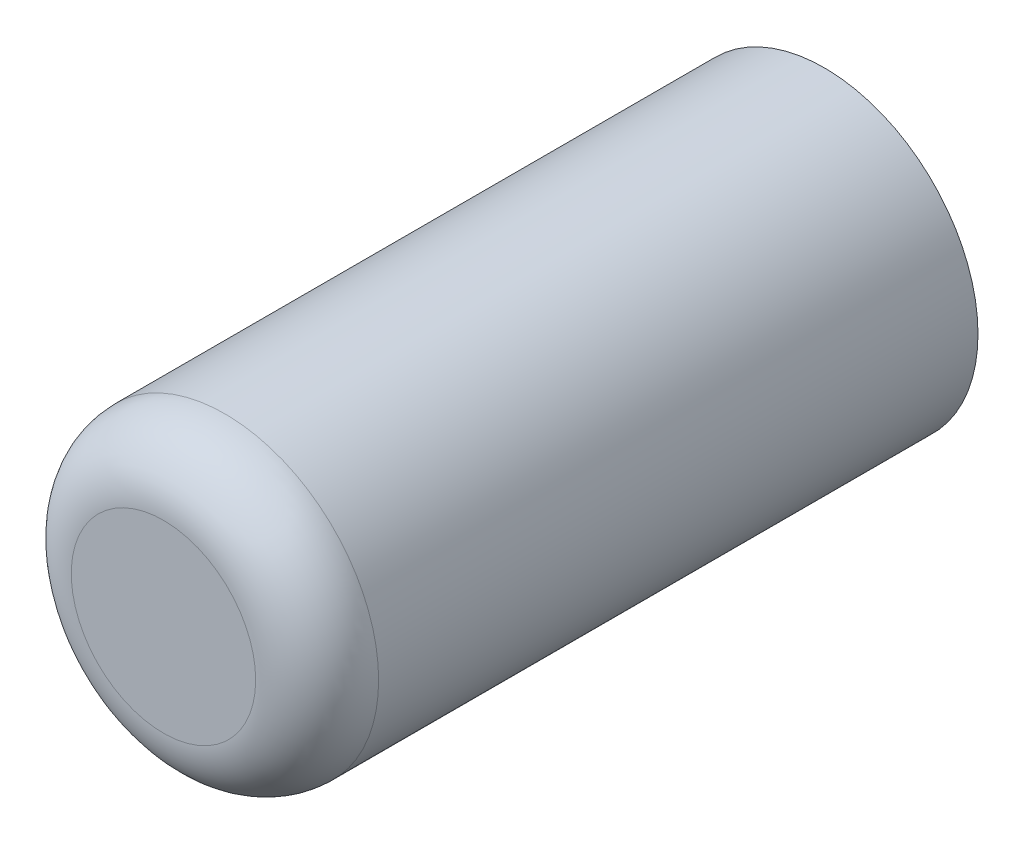
from build123d import *

# Parameters (mm, degrees)
SKETCH1_R           = 5
BOSS_EXTRUDE1_DEPTH = 11.5
SKETCH2_R           = 5
BOSS_EXTRUDE2_DEPTH = 10
FILLET2_R           = 2


with BuildPart() as part:
    # Sketch1 → Boss-Extrude1 (new body)
    with BuildSketch(Plane.XY):
        Circle(SKETCH1_R)
        with BuildLine():
            Line((-2.680951324, 2.25), (0, 2.25))
            Line((0, 2.25), (2.680951324, 2.25))
            ThreePointArc((2.680951324, 2.25), (0, -3.5), (-2.680951324, 2.25))
        make_face(mode=Mode.SUBTRACT)
    extrude(amount=BOSS_EXTRUDE1_DEPTH)

    # Sketch2 → Boss-Extrude2 (add)
    with BuildSketch(Plane.XY.offset(11.5)):
        Circle(SKETCH2_R)
    extrude(amount=BOSS_EXTRUDE2_DEPTH)

    # Fillet2
    fillet2_edges = [part.edges().sort_by_distance(p)[0] for p in [
        (-5, 0, 21.5),
    ]]
    fillet(fillet2_edges, radius=FILLET2_R)


solid = part.part
